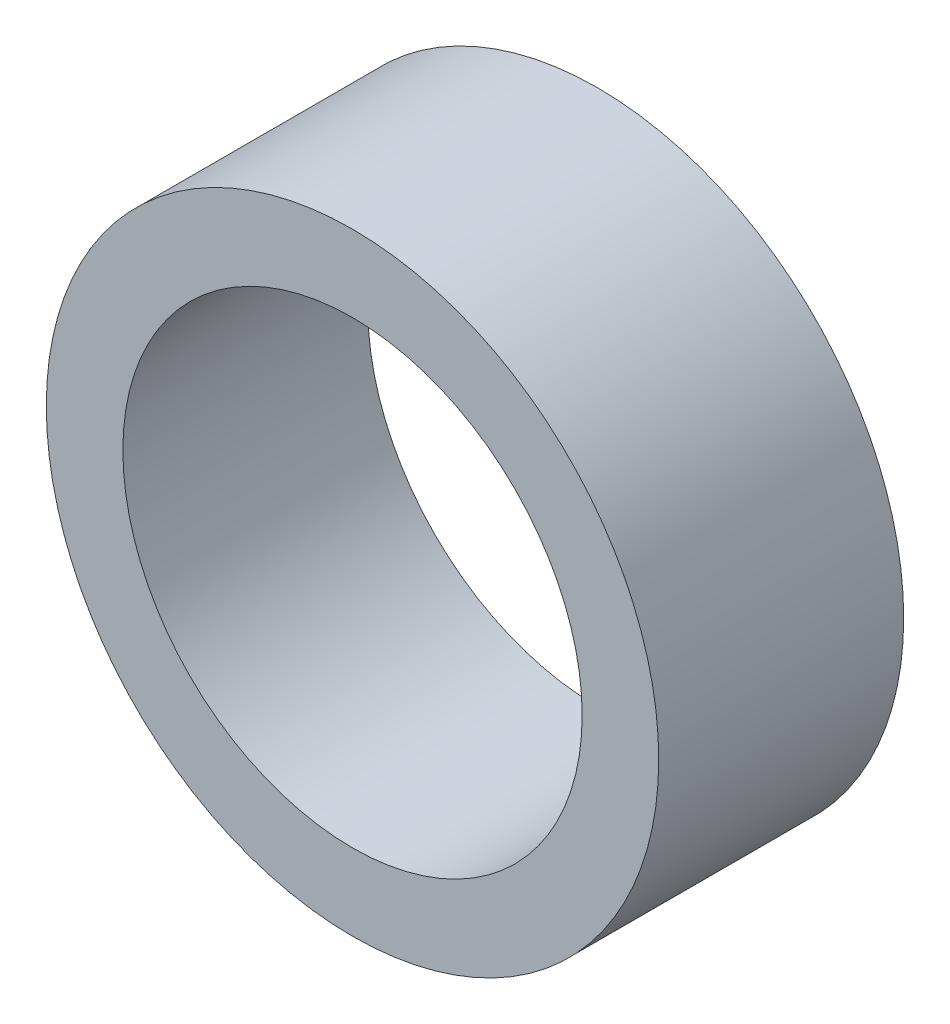
from build123d import *

# Parameters (mm, degrees)
SKETCH_1_R      = 4
SKETCH_1_R_2    = 3
EXTRUDE_1_DEPTH = 3.2


with BuildPart() as part:
    # 草图1 → 凸台-拉伸1 (new body)
    with BuildSketch(Plane.XY):
        Circle(SKETCH_1_R)
        Circle(SKETCH_1_R_2, mode=Mode.SUBTRACT)
    extrude(amount=EXTRUDE_1_DEPTH)


solid = part.part
